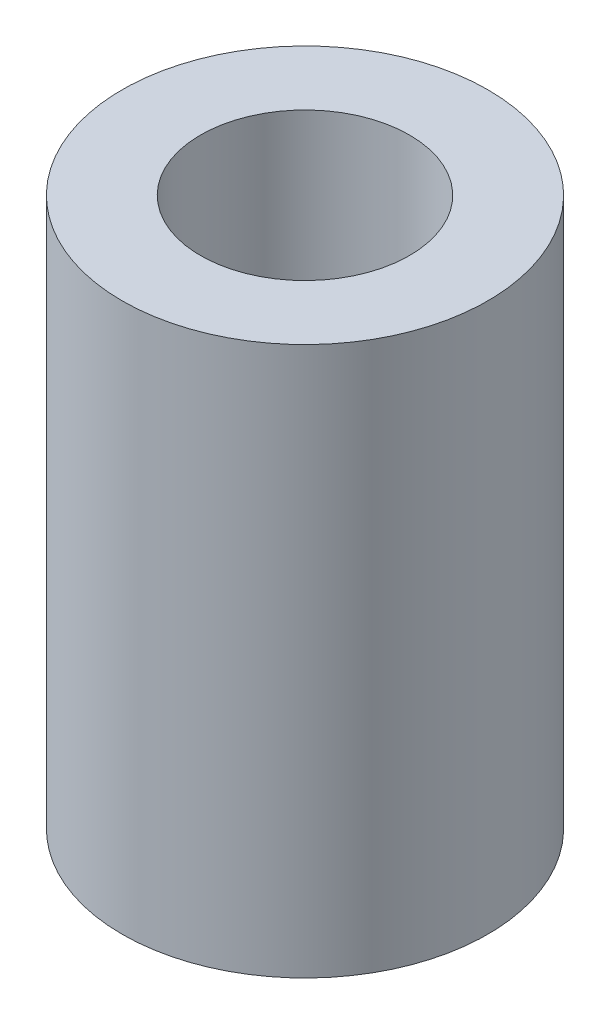
from build123d import *

# Parameters (mm, degrees)
SKETCH1_R           = 3.5
SKETCH1_R_2         = 2
BOSS_EXTRUDE1_DEPTH = 10.5


with BuildPart() as part:
    # Sketch1 → Boss-Extrude1 (new body)
    with BuildSketch(Plane(origin=(0, 0, 0), x_dir=(1, 0, 0), z_dir=(0, 1, 0))):
        with Locations(Location((0, 0, 0), (0, 0, 90))):
            Circle(SKETCH1_R)
        with Locations(Location((0, 0, 0), (0, 0, 90))):
            Circle(SKETCH1_R_2, mode=Mode.SUBTRACT)
    extrude(amount=BOSS_EXTRUDE1_DEPTH)


solid = part.part
